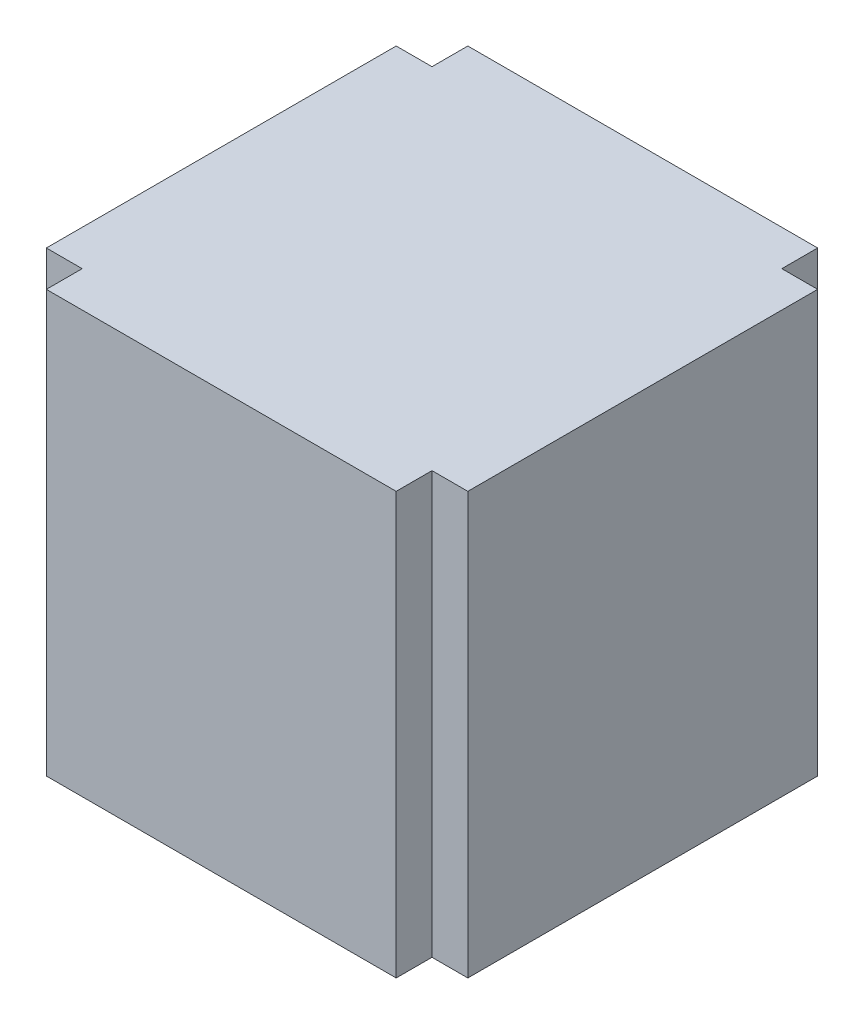
from build123d import *

# Parameters (mm, degrees)
BOSS_EXTRUDE1_DEPTH = 50


with BuildPart() as part:
    # Sketch1 → Boss-Extrude1 (new, symmetric)
    with BuildSketch(Plane(origin=(0, 0, 0), x_dir=(1, 0, 0), z_dir=(0, 1, 0))):
        Polygon((41.5, 41.5), (50, 41.5), (50, -41.5), (41.5, -41.5), (41.5, -50), (-41.5, -50), (-41.5, -41.5), (-50, -41.5), (-50, 41.5), (-41.5, 41.5), (-41.5, 50), (41.5, 50), align=None)
    extrude(amount=BOSS_EXTRUDE1_DEPTH, both=True)


solid = part.part
